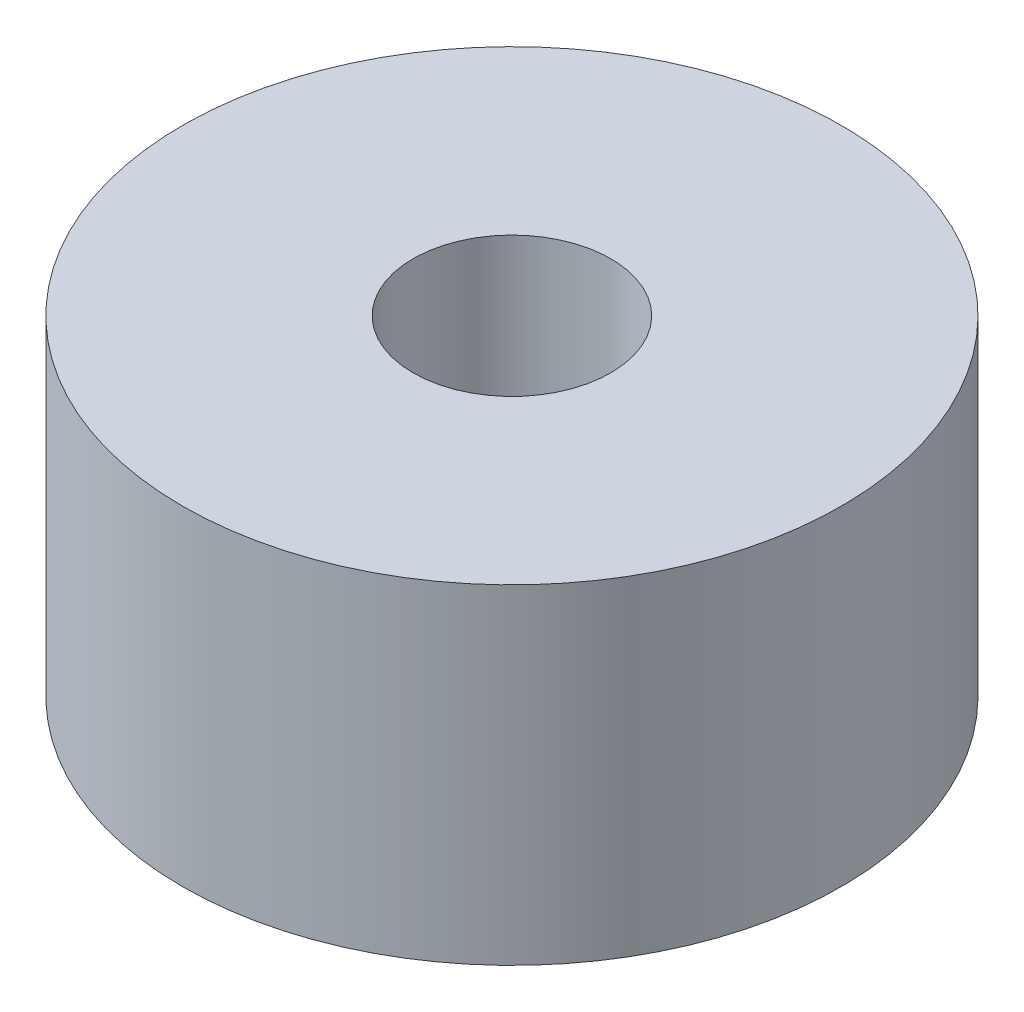
from build123d import *

# Parameters (mm, degrees)
SKETCH1_W = 70
SKETCH1_H = 100


with BuildPart() as part:
    # Sketch1 → Revolve1 (revolve)
    with BuildSketch(Plane(origin=(0, 0, 0), x_dir=(0, 0, -1), z_dir=(1, 0, 0))):
        with Locations((-65, 0)):
            Rectangle(SKETCH1_W, SKETCH1_H)
    revolve(axis=Axis((0, 96.971657253, 0), (0, -1, 0)))


solid = part.part
